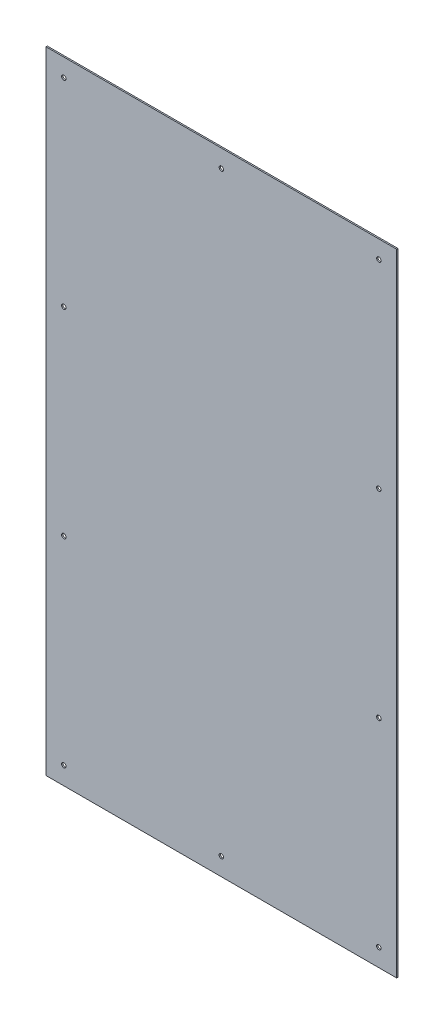
from build123d import *

# Parameters (mm, degrees)
CROQUIS1_W              = 500
CROQUIS1_H              = 900
SALIENTE_EXTRUIR1_DEPTH = 1.9
CROQUIS2_R              = 3.175
CORTAR_EXTRUIR1_DEPTH   = 10


with BuildPart() as part:
    # Croquis1 → Saliente-Extruir1 (new body)
    with BuildSketch(Plane.XY):
        Rectangle(CROQUIS1_W, CROQUIS1_H)
    extrude(amount=SALIENTE_EXTRUIR1_DEPTH)

    # Croquis2 → Cortar-Extruir1 (cut)
    with BuildSketch(Plane.XY.offset(1.9)):
        with Locations((-224.6, 424.6)):
            Circle(CROQUIS2_R)
        with Locations((224.6, 424.6)):
            Circle(CROQUIS2_R)
        with Locations((224.6, -424.6)):
            Circle(CROQUIS2_R)
        with Locations((-224.6, -424.6)):
            Circle(CROQUIS2_R)
        with Locations((-224.6, 141.54)):
            Circle(CROQUIS2_R)
        with Locations((-224.6, -141.52)):
            Circle(CROQUIS2_R)
        with Locations((224.6, -141.52)):
            Circle(CROQUIS2_R)
        with Locations((224.6, 141.54)):
            Circle(CROQUIS2_R)
        with Locations((0, 424.6)):
            Circle(CROQUIS2_R)
        with Locations((0, -424.6)):
            Circle(CROQUIS2_R)
    extrude(amount=-CORTAR_EXTRUIR1_DEPTH, mode=Mode.SUBTRACT)


solid = part.part
